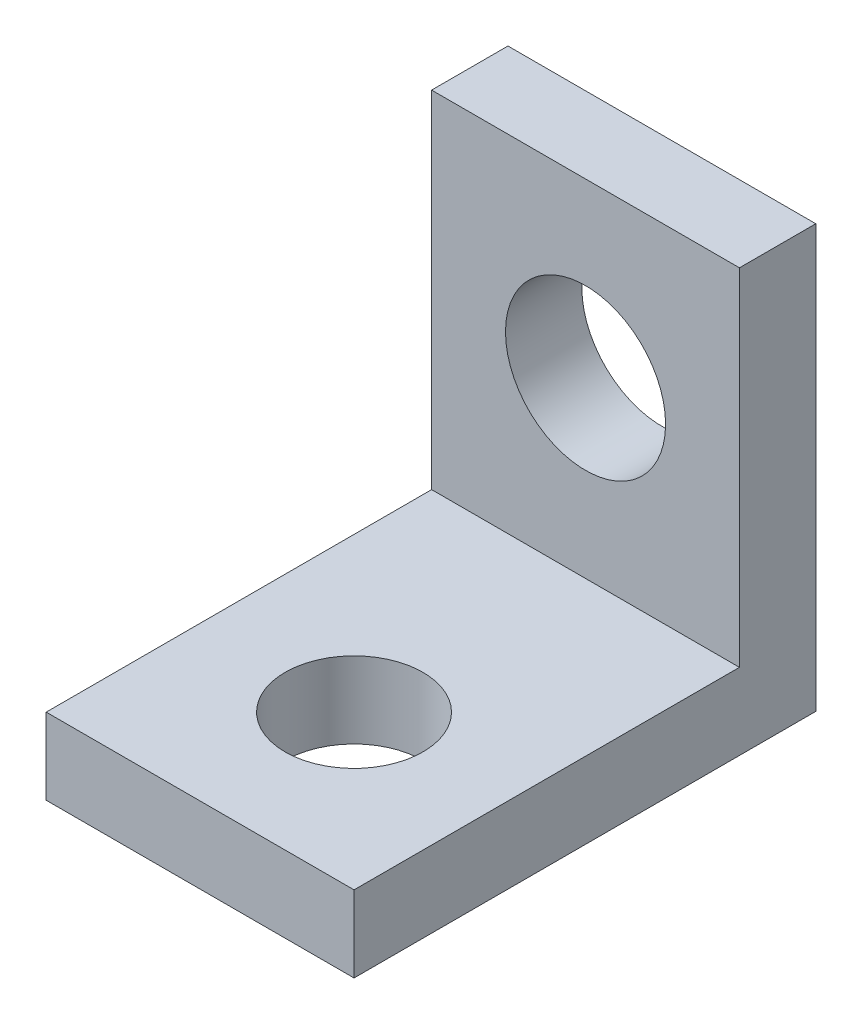
from build123d import *

# Parameters (mm, degrees)
BOSS_EXTRUDE1_DEPTH = 6.35
CUT_EXTRUDE1_REACH  = 15.395
SKETCH2_R           = 1.651
CUT_EXTRUDE2_REACH  = 15.49
SKETCH3_R           = 1.4224


with BuildPart() as part:
    # Sketch1 → Boss-Extrude1 (new body)
    with BuildSketch(Plane(origin=(0, 0, 0), x_dir=(0, 0, -1), z_dir=(1, 0, 0))):
        Polygon((0, 0), (0, 8.7122), (-1.5748, 8.7122), (-1.5748, 1.5748), (-9.525, 1.5748), (-9.525, 0), align=None)
    extrude(amount=-BOSS_EXTRUDE1_DEPTH)

    # Sketch2 → Cut-Extrude1 (cut, up to next)
    with BuildSketch(Plane.XY.offset(1.5748), mode=Mode.PRIVATE) as cut_extrude1_sk1:
        with Locations((-3.175, 5.1562)):
            Circle(SKETCH2_R)
    cut_extrude1_tool1 = extrude(cut_extrude1_sk1.sketch, amount=-CUT_EXTRUDE1_REACH, mode=Mode.PRIVATE) & part.part
    add(cut_extrude1_tool1.solids().sort_by_distance((-3.175, 5.1562, 1.5748))[0], mode=Mode.SUBTRACT)

    # Sketch3 → Cut-Extrude2 (cut, up to next)
    with BuildSketch(Plane(origin=(0, 1.5748, 0), x_dir=(1, 0, 0), z_dir=(0, 1, 0)), mode=Mode.PRIVATE) as cut_extrude2_sk1:
        with Locations(Location((-3.175, -6.35, 0), (0, 0, 270))):
            Circle(SKETCH3_R)
    cut_extrude2_tool1 = extrude(cut_extrude2_sk1.sketch, amount=-CUT_EXTRUDE2_REACH, mode=Mode.PRIVATE) & part.part
    add(cut_extrude2_tool1.solids().sort_by_distance((-3.175, 1.5748, 6.35))[0], mode=Mode.SUBTRACT)


solid = part.part
